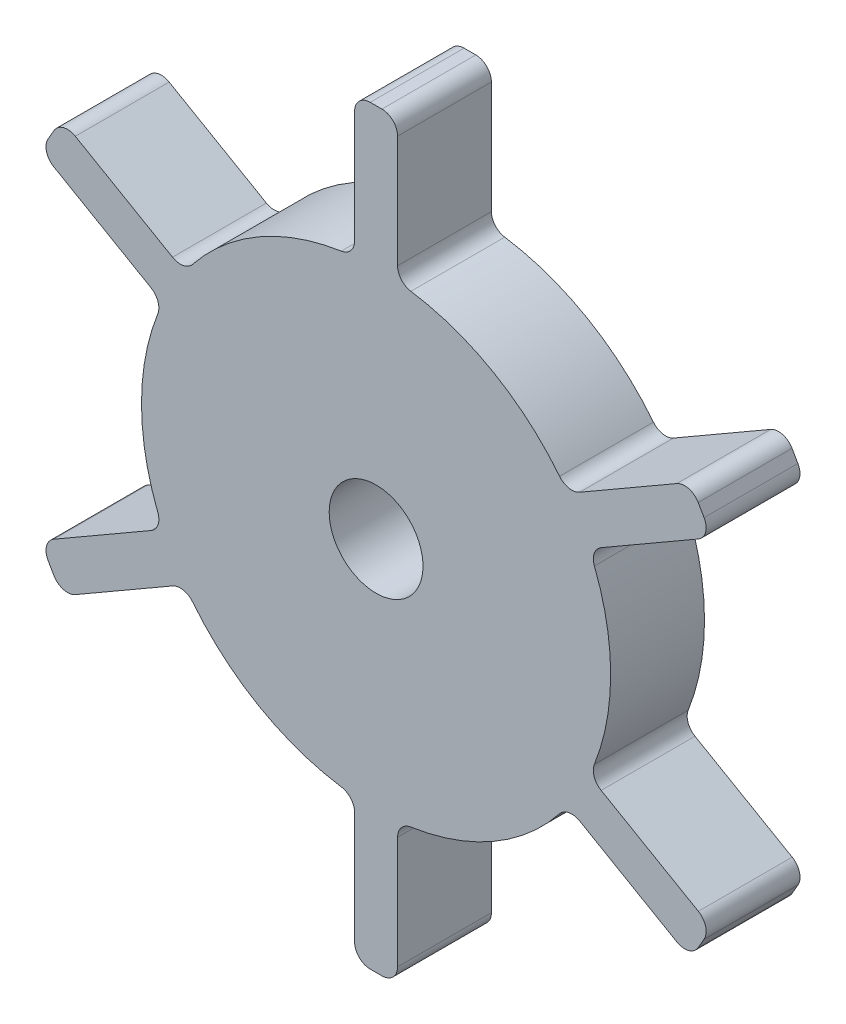
from build123d import *

# Parameters (mm, degrees)
SKETCH1_R                = 381
SKETCH1_R_2              = 76.2
BOSS_EXTRUDE1_DEPTH      = 76.2
BOSS_EXTRUDE2_DEPTH      = 152.4
FILLET1_R                = 25.4
CIRPATTERN1_COUNT        = 6
FILLET1_OF_CIRPATTERN1_R = 25.4


with BuildPart() as part:
    # Sketch1 → Boss-Extrude1 (new, symmetric)
    with BuildSketch(Plane.XY):
        with Locations(Location((0, 0, 0), (0, 0, 180))):
            Circle(SKETCH1_R)
        with Locations(Location((0, 0, 0), (0, 0, 180))):
            Circle(SKETCH1_R_2, mode=Mode.SUBTRACT)
    extrude(amount=BOSS_EXTRUDE1_DEPTH, both=True)

    # Sketch2 → Boss-Extrude2 (add)
    with BuildSketch(Plane.XY.offset(76.2)):
        with BuildLine():
            Line((-34.925, 379.395893988), (-34.925, 609.6))
            Line((-34.925, 609.6), (34.925, 609.6))
            Line((34.925, 609.6), (34.925, 379.395893988))
            ThreePointArc((34.925, 379.395893988), (0, 381), (-34.925, 379.395893988))
        make_face()
    boss_extrude2 = extrude(amount=-BOSS_EXTRUDE2_DEPTH)

    # Fillet1
    fillet1_edges = [part.edges().sort_by_distance(p)[0] for p in [
        (34.925, 379.395893988, 0),
        (-34.925, 379.395893988, 0),
        (-34.925, 609.6, 0),
        (34.925, 609.6, 0),
    ]]
    fillet(fillet1_edges, radius=FILLET1_R)

    # CirPattern1: Boss-Extrude2 ×6 about axis
    cirpattern1_axis = Axis((0, 0, 0), (0, 0, 1))
    for i in range(1, CIRPATTERN1_COUNT):
        add(boss_extrude2.rotate(cirpattern1_axis, i * 360 / CIRPATTERN1_COUNT))

    # Fillet1 of CirPattern1
    fillet1_of_cirpattern1_edges = [part.edges().sort_by_distance(p)[0] for p in [
        (-311.103982285, 219.943884221, 0),
        (-346.028982285, 159.452009767, 0),
        (-545.391586147, 274.554062773, 0),
        (-510.466586147, 335.045937227, 0),
        (-346.028982285, -159.452009767, 0),
        (-311.103982285, -219.943884221, 0),
        (-510.466586147, -335.045937227, 0),
        (-545.391586147, -274.554062773, 0),
        (-34.925, -379.395893988, 0),
        (34.925, -379.395893988, 0),
        (34.925, -609.6, 0),
        (-34.925, -609.6, 0),
        (311.103982285, -219.943884221, 0),
        (346.028982285, -159.452009767, 0),
        (545.391586147, -274.554062773, 0),
        (510.466586147, -335.045937227, 0),
        (346.028982285, 159.452009767, 0),
        (311.103982285, 219.943884221, 0),
        (510.466586147, 335.045937227, 0),
        (545.391586147, 274.554062773, 0),
    ]]
    fillet(fillet1_of_cirpattern1_edges, radius=FILLET1_OF_CIRPATTERN1_R)


solid = part.part
